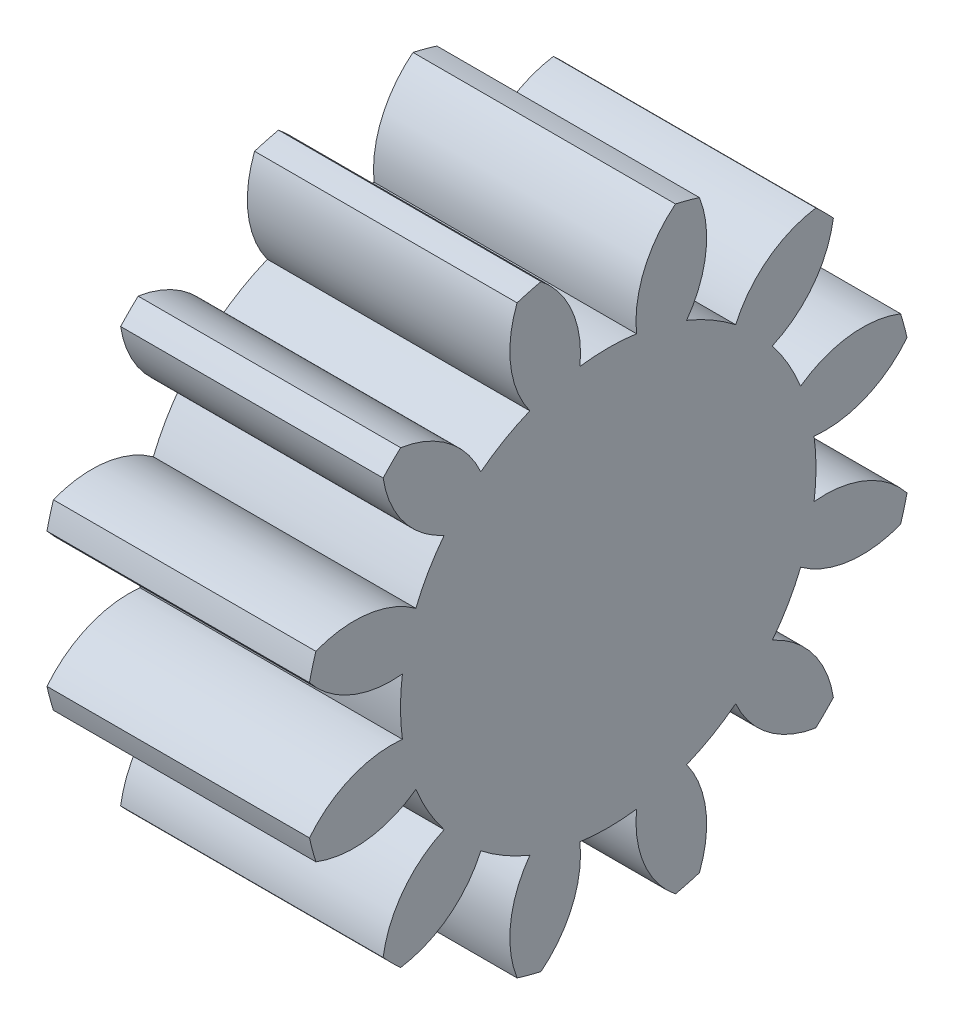
from build123d import *

# Parameters (mm, degrees)
BASPROSKE_W         = 9.525
BASPROSKE_H         = 11.1125
TOOTHCUT_DEPTH      = 19.376641083
TEETHCUTS_COUNT     = 12
BORSKE_R            = 3.175
BORE_DEPTH          = 9.525
BOSS_EXTRUDE1_START = -25.4
SKETCH2_R           = 7.539355
BOSS_EXTRUDE1_DEPTH = 25.4
CUT_EXTRUDE1_DEPTH  = 20
SKETCH5_R           = 1.905
CUT_EXTRUDE2_DEPTH  = 24.605363577
SKETCH6_R           = 12.7
SKETCH6_R_2         = 5.7785
CUT_EXTRUDE3_DEPTH  = 15.875
SKETCH7_R           = 5.7785
CUT_EXTRUDE4_DEPTH  = 23.070094739
BOSS_EXTRUDE2_START = 4.125
BOSS_EXTRUDE2_DEPTH = 4.125
CUT_EXTRUDE5_DEPTH  = 7.62
FILLET1_R           = 1.5875


with BuildPart() as part:
    # BasProSke → Base-Revolve (revolve)
    with BuildSketch(Plane(origin=(0, 0, 0), x_dir=(1, 0, 0), z_dir=(0, 1, 0)), mode=Mode.PRIVATE) as base_revolve_sk:
        with Locations((4.7625, 5.55625)):
            Rectangle(BASPROSKE_W, BASPROSKE_H)
    revolve(base_revolve_sk.sketch.rotate(Axis((-10, 0, 0), (1, 0, 0)), 180), axis=Axis((-10, 0, 0), (1, 0, 0)))

    # TooCutSke → ToothCut (cut, through all)
    with BuildSketch(Plane(origin=(0, 0, 0), x_dir=(0, 0, -1), z_dir=(1, 0, 0))):
        with BuildLine():
            ThreePointArc((1.026937745, 7.469087808), (0, 7.539355), (-1.026937745, 7.469087808))
            ThreePointArc((-1.026937745, 7.469087808), (-1.30857978, 9.35080814), (-2.465050847, 10.861691431))
            ThreePointArc((-2.465050847, 10.861691431), (0, 11.1379), (2.465050847, 10.861691431))
            ThreePointArc((2.465050847, 10.861691431), (1.30857978, 9.35080814), (1.026937745, 7.469087808))
        make_face()
    toothcut = extrude(amount=TOOTHCUT_DEPTH, mode=Mode.SUBTRACT)

    # TeethCuts: ToothCut ×12 about axis
    teethcuts_axis = Axis((0, 0, 0), (1, 0, 0))
    for i in range(1, TEETHCUTS_COUNT):
        add(toothcut.rotate(teethcuts_axis, i * 360 / TEETHCUTS_COUNT), mode=Mode.SUBTRACT)

    # BorSke → Bore (cut, symmetric)
    with BuildSketch(Plane(origin=(0, 0, 0), x_dir=(0, 0, -1), z_dir=(1, 0, 0))):
        with Locations(Location((0, 0, 0), (0, 0, 180))):
            Circle(BORSKE_R)
    extrude(amount=BORE_DEPTH, both=True, mode=Mode.SUBTRACT)

    # Sketch2 → Boss-Extrude1 (add)
    with BuildSketch(Plane(origin=(9.525, 0, 0), x_dir=(0, 0, -1), z_dir=(1, 0, 0)).offset(BOSS_EXTRUDE1_START)):
        with Locations(Location((0, 0, 0), (0, 0, 172.171388978))):
            Circle(SKETCH2_R)
    extrude(amount=BOSS_EXTRUDE1_DEPTH)

    # Sketch3 → Cut-Extrude1 (cut)
    with BuildSketch(Plane.ZY.offset(15.875)):
        with BuildLine():
            Line((-1.778, 2.8575), (1.778, 2.8575))
            ThreePointArc((1.778, 2.8575), (0, -3.3655), (-1.778, 2.8575))
        make_face()
    extrude(amount=-CUT_EXTRUDE1_DEPTH, mode=Mode.SUBTRACT)

    # Sketch5 → Cut-Extrude2 (cut, through all)
    with BuildSketch(Plane.XZ.offset(-2.8575)):
        with Locations(Location((-12.065, 0, 0), (0, 0, 270))):
            Circle(SKETCH5_R)
    extrude(amount=-CUT_EXTRUDE2_DEPTH, mode=Mode.SUBTRACT)

    # Sketch6 → Cut-Extrude3 (cut)
    with BuildSketch(Plane.ZY.offset(15.875)):
        Circle(SKETCH6_R)
        Circle(SKETCH6_R_2, mode=Mode.SUBTRACT)
    extrude(amount=-CUT_EXTRUDE3_DEPTH, mode=Mode.SUBTRACT)

    # Sketch7 → Cut-Extrude4 (cut, through all)
    with BuildSketch(Plane.ZY):
        Circle(SKETCH7_R)
    extrude(amount=CUT_EXTRUDE4_DEPTH, mode=Mode.SUBTRACT)

    # Sketch8 → Boss-Extrude2 (add)
    with BuildSketch(Plane.ZY.offset(-4.125).offset(BOSS_EXTRUDE2_START)):
        with BuildLine():
            Line((1.778, 2.8575), (-1.778, 2.8575))
            ThreePointArc((-1.778, 2.8575), (0, -3.3655), (1.778, 2.8575))
        make_face()
    extrude(amount=-BOSS_EXTRUDE2_DEPTH)

    # Sketch9 → Cut-Extrude5 (cut)
    with BuildSketch(Plane.ZY):
        Polygon((5.588, 0), (2.794, 4.839349956), (-2.794, 4.839349956), (-5.588, 0), (-2.794, -4.839349956), (2.794, -4.839349956), align=None)
    extrude(amount=-CUT_EXTRUDE5_DEPTH, mode=Mode.SUBTRACT)

    # Fillet1
    fillet1_edges = [part.edges().sort_by_distance(p)[0] for p in [
        (7.62, 4.839349956, 0),
        (7.62, 2.419674978, 4.191),
        (7.62, -2.419674978, 4.191),
        (7.62, -4.839349956, 0),
        (7.62, -2.419674978, -4.191),
        (7.62, 2.419674978, -4.191),
    ]]
    fillet(fillet1_edges, radius=FILLET1_R)


solid = part.part
